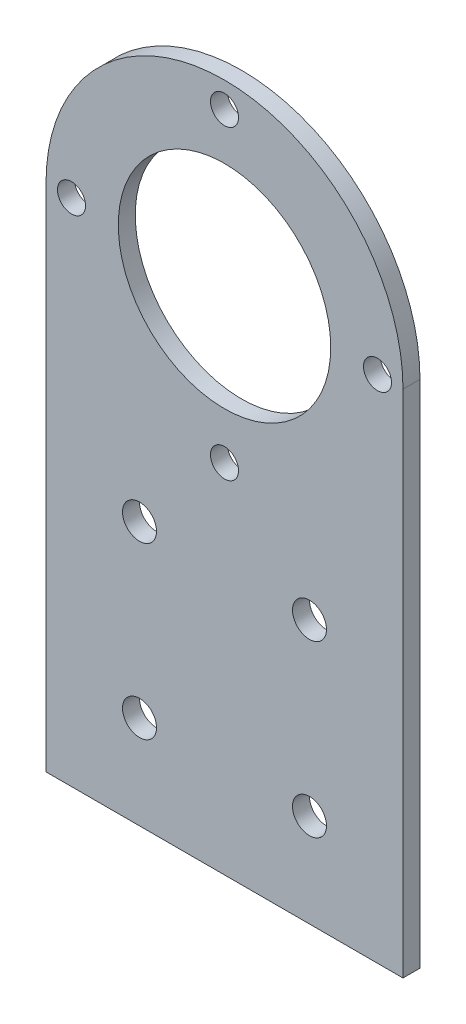
from build123d import *

# Parameters (mm, degrees)
ESTRUSIONE_ESTRUSIONE1_DEPTH = 2
SCHIZZO2_R                   = 1.65
TAGLIO_ESTRUSIONE1_DEPTH     = 2
SCHIZZO3_R                   = 12.5
TAGLIO_ESTRUSIONE2_DEPTH     = 2
SCHIZZO4_R                   = 2
TAGLIO_ESTRUSIONE3_DEPTH     = 2


with BuildPart() as part:
    # Schizzo1 → Estrusione-Estrusione1 (new body)
    with BuildSketch(Plane.XY):
        with BuildLine():
            Line((21, 0), (21, -60))
            Line((21, -60), (-21, -60))
            Line((-21, -60), (-21, 0))
            ThreePointArc((-21, 0), (0, 21), (21, 0))
        make_face()
    extrude(amount=ESTRUSIONE_ESTRUSIONE1_DEPTH)

    # Schizzo2 → Taglio-Estrusione1 (cut)
    with BuildSketch(Plane.XY.offset(2)):
        with Locations((-18, 0)):
            Circle(SCHIZZO2_R)
        with Locations((18, 0)):
            Circle(SCHIZZO2_R)
        with Locations((0, 18)):
            Circle(SCHIZZO2_R)
        with Locations((0, -18)):
            Circle(SCHIZZO2_R)
    extrude(amount=-TAGLIO_ESTRUSIONE1_DEPTH, mode=Mode.SUBTRACT)

    # Schizzo3 → Taglio-Estrusione2 (cut)
    with BuildSketch(Plane.XY.offset(2)):
        Circle(SCHIZZO3_R)
    extrude(amount=-TAGLIO_ESTRUSIONE2_DEPTH, mode=Mode.SUBTRACT)

    # Schizzo4 → Taglio-Estrusione3 (cut)
    with BuildSketch(Plane.XY.offset(2)):
        with Locations((-10, -29)):
            Circle(SCHIZZO4_R)
        with Locations((10, -29)):
            Circle(SCHIZZO4_R)
        with Locations((10, -49)):
            Circle(SCHIZZO4_R)
        with Locations((-10, -49)):
            Circle(SCHIZZO4_R)
    extrude(amount=-TAGLIO_ESTRUSIONE3_DEPTH, mode=Mode.SUBTRACT)


solid = part.part
